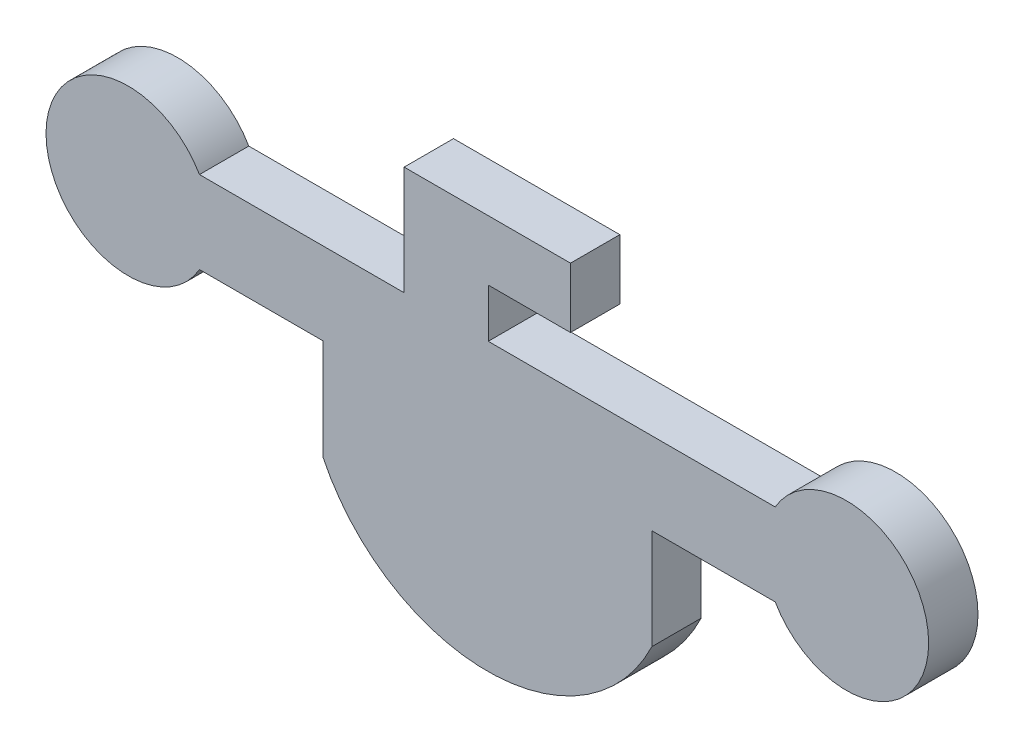
from build123d import *

# Parameters (mm, degrees)
BASE_EXTRUDE_DEPTH = 3


with BuildPart() as part:
    # Sketch1 → Base-Extrude (new body)
    with BuildSketch(Plane.XY):
        with BuildLine():
            Line((-1351.280186532, 100.515097097), (-1341.166910128, 100.515097097))
            Line((-1341.166910128, 100.515097097), (-1341.166910128, 96.861073329))
            Line((-1341.166910128, 96.861073329), (-1346.166910128, 96.861073329))
            Line((-1346.166910128, 96.861073329), (-1346.166910128, 93.899820126))
            Line((-1346.166910128, 93.899820126), (-1328.72354833, 93.899820126))
            ThreePointArc((-1328.72354833, 93.899820126), (-1319.393421311, 91.399820126), (-1328.72354833, 88.899820126))
            Line((-1328.72354833, 88.899820126), (-1336.22354833, 88.899820126))
            Line((-1336.22354833, 88.899820126), (-1336.22354833, 82.793437515))
            ThreePointArc((-1336.22354833, 82.793437515), (-1346.22354833, 76.504450604), (-1356.22354833, 82.793437515))
            Line((-1356.22354833, 82.793437515), (-1356.22354833, 88.899820126))
            Line((-1356.22354833, 88.899820126), (-1363.72354833, 88.899820126))
            ThreePointArc((-1363.72354833, 88.899820126), (-1373.053675349, 91.399820126), (-1363.72354833, 93.899820126))
            Line((-1363.72354833, 93.899820126), (-1351.280186532, 93.899820126))
            Line((-1351.280186532, 93.899820126), (-1351.280186532, 100.515097097))
        make_face()
    extrude(amount=BASE_EXTRUDE_DEPTH)


solid = part.part
